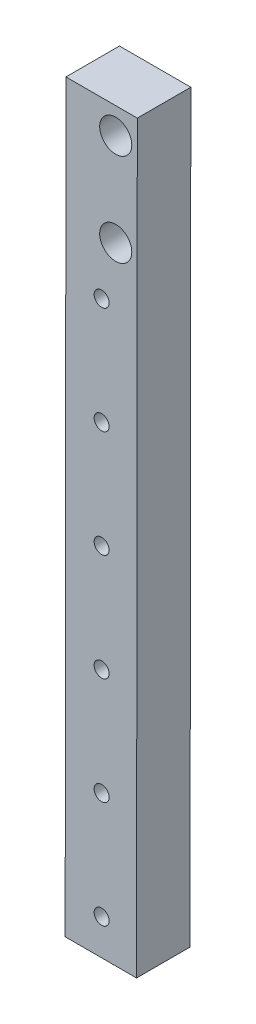
from build123d import *

# Parameters (mm, degrees)
SKETCH2_R           = 2.1
SKETCH2_R_2         = 4.5
BOSS_EXTRUDE1_DEPTH = 15


with BuildPart() as part:
    # Sketch2 → Boss-Extrude1 (new body)
    with BuildSketch(Plane.XY):
        Polygon((38.1, 58.8), (34.845457521, 58.8), (33.373016026, 58.8), (28.545258062, 58.8), (27.023826138, 58.8), (24.630195866, 58.8), (18.1, 58.8), (17.8856558, -150.026728087), (37.8856558, -150.026728087), align=None)
        with Locations((28.1, -140.026728087)):
            Circle(SKETCH2_R, mode=Mode.SUBTRACT)
        with Locations((28.1, -110.026728087)):
            Circle(SKETCH2_R, mode=Mode.SUBTRACT)
        with Locations((28.1, -80.026728087)):
            Circle(SKETCH2_R, mode=Mode.SUBTRACT)
        with Locations((28.1, -50.026728087)):
            Circle(SKETCH2_R, mode=Mode.SUBTRACT)
        with Locations((28.1, -20.026728087)):
            Circle(SKETCH2_R, mode=Mode.SUBTRACT)
        with Locations((28.1, 9.973271913)):
            Circle(SKETCH2_R, mode=Mode.SUBTRACT)
        with Locations((32.05, 25.5)):
            Circle(SKETCH2_R_2, mode=Mode.SUBTRACT)
        with Locations((32.05, 51.5)):
            Circle(SKETCH2_R_2, mode=Mode.SUBTRACT)
    extrude(amount=BOSS_EXTRUDE1_DEPTH)


solid = part.part
